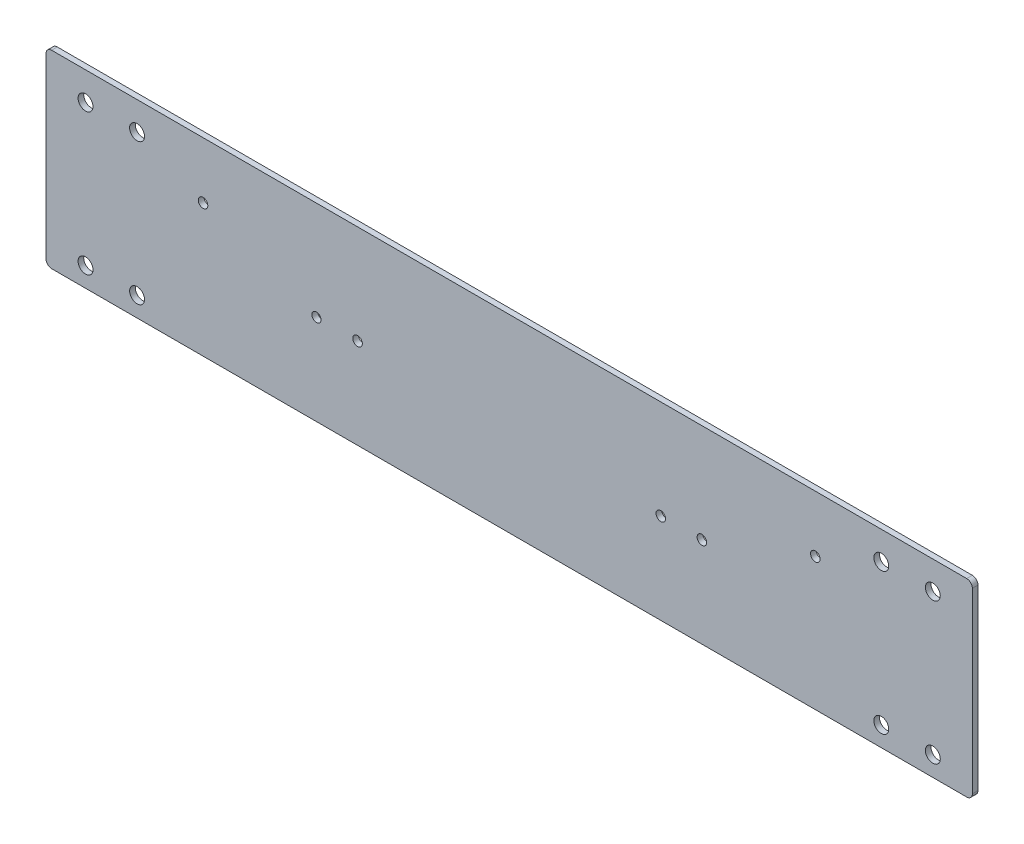
from build123d import *

# Parameters (mm, degrees)
SKETCH1_W           = 1041.4
SKETCH1_H           = 212.725
BOSS_EXTRUDE1_DEPTH = 6.35
SKETCH4_R           = 8.382
CUT_EXTRUDE1_DEPTH  = 532.490163508
SKETCH5_R           = 5.159375
SKETCH5_R_2         = 5.3578125
CUT_EXTRUDE2_DEPTH  = 532.490163508
FILLET1_R           = 6.35


with BuildPart() as part:
    # Sketch1 → Boss-Extrude1 (new body)
    with BuildSketch(Plane.XY):
        Rectangle(SKETCH1_W, SKETCH1_H)
    extrude(amount=BOSS_EXTRUDE1_DEPTH)

    # Sketch4 → Cut-Extrude1 (cut, through all)
    with BuildSketch(Plane.XY.offset(6.35)):
        with Locations((476.25, 74.6125)):
            Circle(SKETCH4_R)
        with Locations((418.310341604, 74.6125)):
            Circle(SKETCH4_R)
        with Locations((-476.25, 74.6125)):
            Circle(SKETCH4_R)
        with Locations((-418.338, 74.6125)):
            Circle(SKETCH4_R)
        with Locations((476.25, -84.1375)):
            Circle(SKETCH4_R)
        with Locations((418.310341686, -84.1375)):
            Circle(SKETCH4_R)
        with Locations((-476.25, -84.1375)):
            Circle(SKETCH4_R)
        with Locations((-418.310341686, -84.1375)):
            Circle(SKETCH4_R)
    extrude(amount=-CUT_EXTRUDE1_DEPTH, mode=Mode.SUBTRACT)

    # Sketch5 → Cut-Extrude2 (cut, through all)
    with BuildSketch(Plane.XY.offset(6.35)):
        with Locations((-216.662, -4.7625)):
            Circle(SKETCH5_R)
        with Locations((-170.434, -4.7625)):
            Circle(SKETCH5_R_2)
        with Locations((170.434, -4.7625)):
            Circle(SKETCH5_R_2)
        with Locations((216.662, -4.7625)):
            Circle(SKETCH5_R_2)
        with Locations((344.17, 42.8625)):
            Circle(SKETCH5_R_2)
        with Locations((-344.17, 42.8625)):
            Circle(SKETCH5_R_2)
    extrude(amount=-CUT_EXTRUDE2_DEPTH, mode=Mode.SUBTRACT)

    # Fillet1
    fillet1_edges = [part.edges().sort_by_distance(p)[0] for p in [
        (-520.7, -106.3625, 3.175),
        (-520.7, 106.3625, 3.175),
        (520.7, 106.3625, 3.175),
        (520.7, -106.3625, 3.175),
    ]]
    fillet(fillet1_edges, radius=FILLET1_R)


solid = part.part
